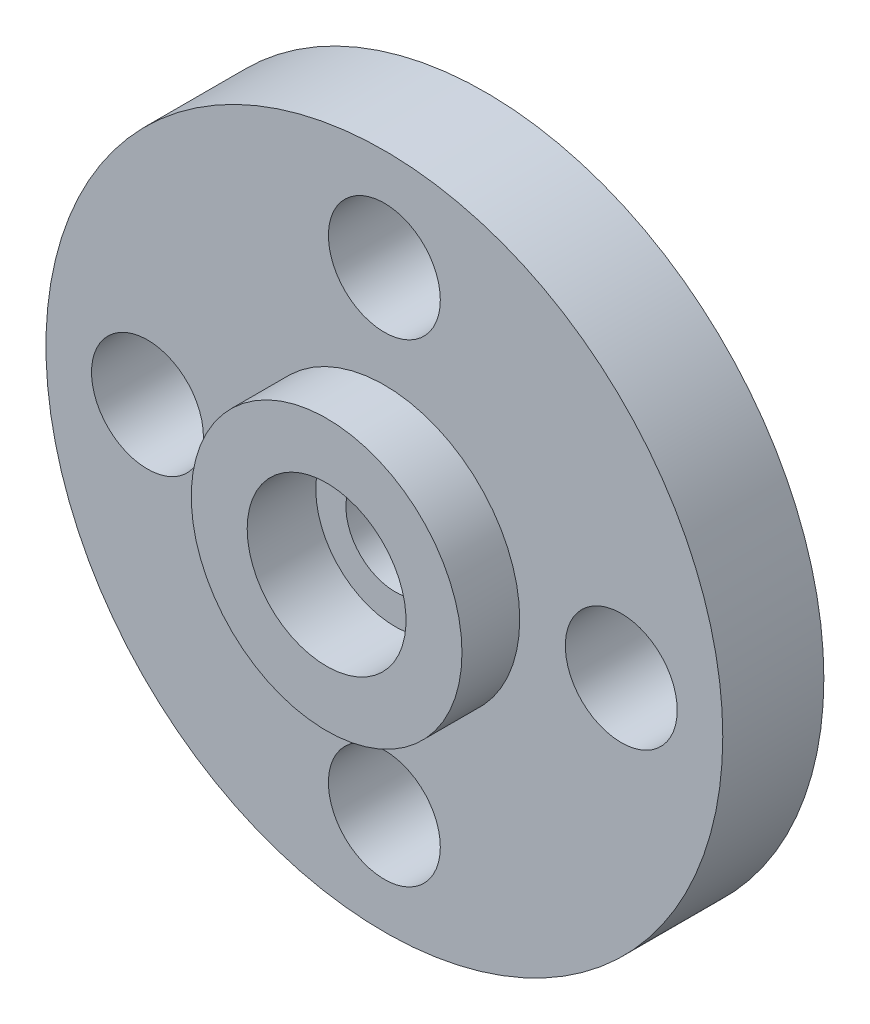
from build123d import *

# Parameters (mm, degrees)
SKETCH1_R         = 17.526
EXTRUDE1_DEPTH    = 6.35
EXTRUDE2_START    = 6.35
SKETCH1_3_R       = 47.625
EXTRUDE2_DEPTH    = 14.224
EXTRUDE3_START    = 20.574
SKETCH1_4_R       = 19.05
EXTRUDE3_DEPTH    = 8.128
EXTRUDE4_START    = 6.35
SKETCH1_5_R       = 7.874
EXTRUDE4_DEPTH    = 14.224
CIRPATTERN1_COUNT = 4
SKETCH3_R         = 11.176
EXTRUDE5_DEPTH    = 9.652
EXTRUDE6_REACH    = 75.213
SKETCH3_3_R       = 6.9342


with BuildPart() as part:
    # Sketch1 → Extrude1 (new body)
    with BuildSketch(Plane.XY):
        Circle(SKETCH1_R)
    extrude(amount=EXTRUDE1_DEPTH)

    # Sketch1<3> → Extrude2 (add)
    with BuildSketch(Plane.XY.offset(EXTRUDE2_START)):
        Circle(SKETCH1_3_R)
    extrude(amount=EXTRUDE2_DEPTH)

    # Sketch1<4> → Extrude3 (add)
    with BuildSketch(Plane.XY.offset(EXTRUDE3_START)):
        Circle(SKETCH1_4_R)
    extrude(amount=EXTRUDE3_DEPTH)

    # Sketch1<5> → Extrude4 (cut)
    with BuildSketch(Plane.XY.offset(EXTRUDE4_START)):
        with Locations((0, 33.3375)):
            Circle(SKETCH1_5_R)
    extrude4 = extrude(amount=EXTRUDE4_DEPTH, mode=Mode.SUBTRACT)

    # CirPattern1: Extrude4 ×4 about axis
    cirpattern1_axis = Axis((0, 0, 0), (0, 0, 1))
    for i in range(1, CIRPATTERN1_COUNT):
        add(extrude4.rotate(cirpattern1_axis, i * 360 / CIRPATTERN1_COUNT), mode=Mode.SUBTRACT)

    # Sketch3 → Extrude5 (cut)
    with BuildSketch(Plane(origin=(0, 0, 28.702), x_dir=(-1, 0, 0), z_dir=(0, 0, -1))):
        Circle(SKETCH3_R)
    extrude(amount=EXTRUDE5_DEPTH, mode=Mode.SUBTRACT)

    # Sketch3<3> → Extrude6 (cut, up to next)
    with BuildSketch(Plane(origin=(0, 0, 28.702), x_dir=(-1, 0, 0), z_dir=(0, 0, -1)), mode=Mode.PRIVATE) as extrude6_sk1:
        with Locations(Location((0, 0, 0), (0, 0, 180))):
            Circle(SKETCH3_3_R)
    extrude6_tool1 = extrude(extrude6_sk1.sketch, amount=EXTRUDE6_REACH, mode=Mode.PRIVATE) & part.part
    add(extrude6_tool1.solids().sort_by_distance((0, 0, 28.702))[0], mode=Mode.SUBTRACT)


solid = part.part
